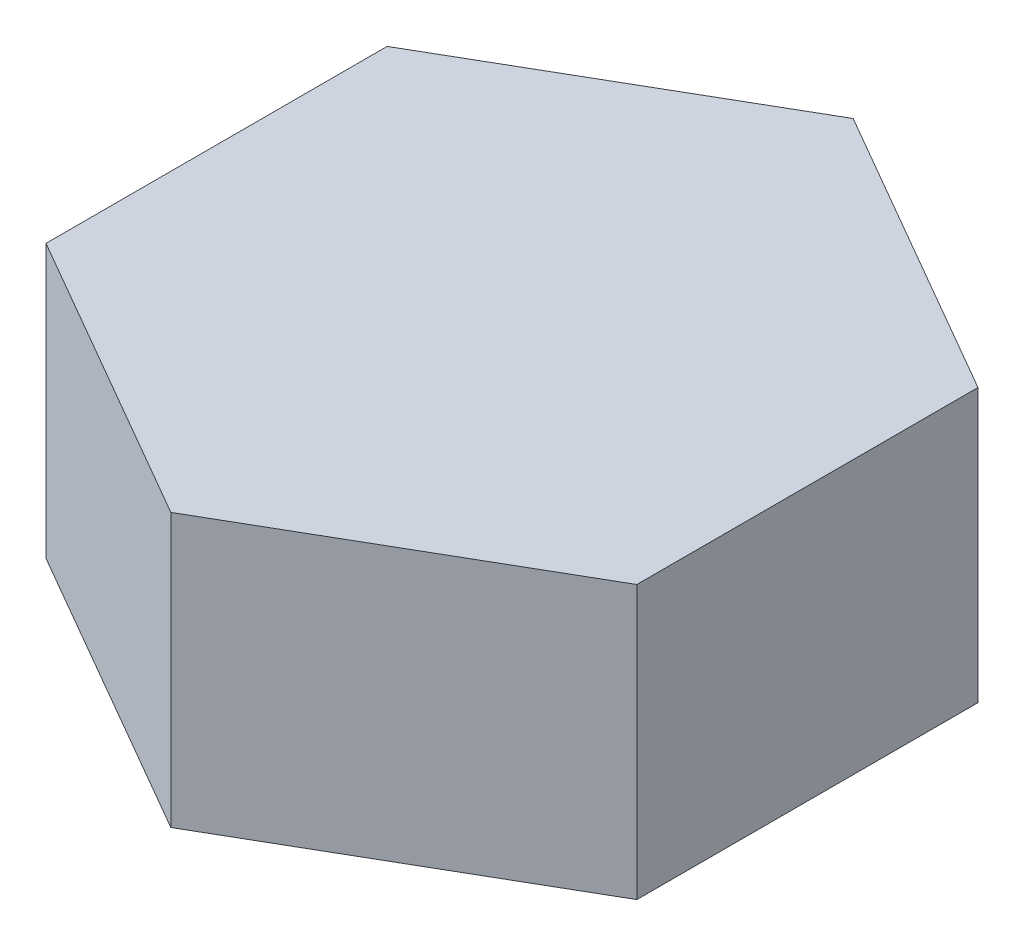
from build123d import *

# Parameters (mm, degrees)
EXTRUDE_1_DEPTH = 20


with BuildPart() as part:
    # 草图1 → 凸台-拉伸1 (new body)
    with BuildSketch(Plane(origin=(0, 0, 0), x_dir=(1, 0, 0), z_dir=(0, 1, 0))):
        Polygon((0, 25), (-21.650635095, 12.5), (-21.650635095, -12.5), (0, -25), (21.650635095, -12.5), (21.650635095, 12.5), align=None)
    extrude(amount=EXTRUDE_1_DEPTH)


solid = part.part
